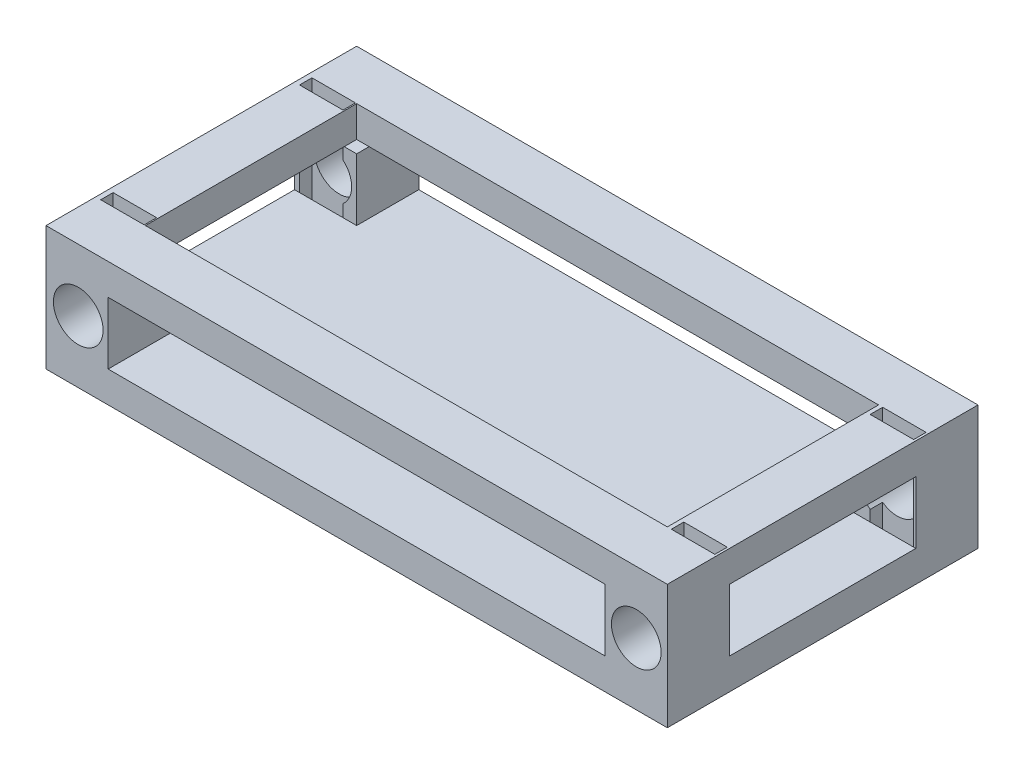
from build123d import *

# Parameters (mm, degrees)
SKETCH_1_W           = 10
SKETCH_1_H           = 10
EXTRUDE_2_DEPTH      = 10
EXTRUDE_2_2_DEPTH    = 10
EXTRUDE_2_3_DEPTH    = 10
EXTRUDE_2_4_DEPTH    = 10
SKETCH_2_W           = 100
SKETCH_2_H           = 50
EXTRUDE_3_DEPTH      = 5
SKETCH_4_W           = 100
SKETCH_4_H           = 5
EXTRUDE_4_DEPTH      = 50
SKETCH_7_R           = 4
CUT_EXTRUDE_7_DEPTH  = 100
SKETCH_8_W           = 84
SKETCH_8_H           = 34
CUT_EXTRUDE_9_DEPTH  = 5
CUT_EXTRUDE_12_REACH = 78.195
SKETCH_10_W          = 7
SKETCH_10_H          = 2
CUT_EXTRUDE_13_REACH = 78.195
SKETCH_12_W          = 7
SKETCH_12_H          = 2


with BuildPart() as part:
    # 草图1 → 凸台-拉伸2 (new body)
    with BuildSketch(Plane(origin=(0, 0, 0), x_dir=(1, 0, 0), z_dir=(0, 1, 0))):
        with Locations((-31.40167364, 31.889818689)):
            Rectangle(SKETCH_1_W, SKETCH_1_H)
    extrude(amount=EXTRUDE_2_DEPTH)



with BuildPart() as body_2:
    # 草图1 → Extrude 2 2 (new body)
    with BuildSketch(Plane(origin=(0, 0, 0), x_dir=(1, 0, 0), z_dir=(0, 1, 0))):
        with Locations((-31.40167364, -8.110181311)):
            Rectangle(SKETCH_1_W, SKETCH_1_H)
    extrude(amount=EXTRUDE_2_2_DEPTH)


with BuildPart() as body_3:
    # 草图1 → Extrude 2 3 (new body)
    with BuildSketch(Plane(origin=(0, 0, 0), x_dir=(1, 0, 0), z_dir=(0, 1, 0))):
        with Locations((58.59832636, 31.889818689)):
            Rectangle(SKETCH_1_W, SKETCH_1_H)
    extrude(amount=EXTRUDE_2_3_DEPTH)


with BuildPart() as body_4:
    # 草图1 → Extrude 2 4 (new body)
    with BuildSketch(Plane(origin=(0, 0, 0), x_dir=(1, 0, 0), z_dir=(0, 1, 0))):
        with Locations((58.59832636, -8.110181311)):
            Rectangle(SKETCH_1_W, SKETCH_1_H)
    extrude(amount=EXTRUDE_2_4_DEPTH)


with BuildPart() as part_1:
    add(part.part)

    add(body_2.part)  # 凸台-拉伸3 merges body 2

    add(body_3.part)  # 凸台-拉伸3 merges body 3

    add(body_4.part)  # 凸台-拉伸3 merges body 4
    # 草图2 → 凸台-拉伸3 (add)
    with BuildSketch(Plane(origin=(0, 0, 0), x_dir=(1, 0, 0), z_dir=(0, 1, 0))):
        with Locations((13.59832636, 11.889818689)):
            Rectangle(SKETCH_2_W, SKETCH_2_H)
    extrude(amount=-EXTRUDE_3_DEPTH)

    # 草图4 → 凸台-拉伸4 (add)
    with BuildSketch(Plane.XY.offset(13.110181311)):
        with Locations((13.59832636, 12.5)):
            Rectangle(SKETCH_4_W, SKETCH_4_H)
    extrude(amount=-EXTRUDE_4_DEPTH)

    # 草图7 → 切除-拉伸7 (cut)
    with BuildSketch(Plane.XY.offset(13.110181311)):
        with Locations((-31.20937541, 5)):
            Circle(SKETCH_7_R)
        with Locations((58.59832636, 5)):
            Circle(SKETCH_7_R)
    extrude(amount=-CUT_EXTRUDE_7_DEPTH, mode=Mode.SUBTRACT)

    # 草图8 → 切除-拉伸9 (cut)
    with BuildSketch(Plane(origin=(0, 15, 0), x_dir=(1, 0, 0), z_dir=(0, 1, 0))):
        with Locations((13.59832636, 11.889818689)):
            Rectangle(SKETCH_8_W, SKETCH_8_H)
    extrude(amount=-CUT_EXTRUDE_9_DEPTH, mode=Mode.SUBTRACT)

    # 草图10 → 切除-拉伸12 (cut, up to next)
    with BuildSketch(Plane(origin=(0, 15, 0), x_dir=(1, 0, 0), z_dir=(0, 1, 0)), mode=Mode.PRIVATE) as cut_extrude_12_sk1:
        with Locations((-32.098969847, 27.889818689)):
            Rectangle(SKETCH_10_W, SKETCH_10_H)
    cut_extrude_12_tool1 = extrude(cut_extrude_12_sk1.sketch, amount=-CUT_EXTRUDE_12_REACH, mode=Mode.PRIVATE) & part_1.part
    add(cut_extrude_12_tool1.solids().sort_by_distance((-32.09897, 15, -27.889819))[0], mode=Mode.SUBTRACT)

    # 草图12 → 切除-拉伸13 (cut, up to next)
    with BuildSketch(Plane(origin=(0, 15, 0), x_dir=(1, 0, 0), z_dir=(0, 1, 0)), mode=Mode.PRIVATE) as cut_extrude_13_sk1:
        with Locations((-32.098969847, -4.110181311)):
            Rectangle(SKETCH_12_W, SKETCH_12_H)
    cut_extrude_13_tool1 = extrude(cut_extrude_13_sk1.sketch, amount=-CUT_EXTRUDE_13_REACH, mode=Mode.PRIVATE) & part_1.part
    # 草图12 → 切除-拉伸13 (cut, up to next)
    with BuildSketch(Plane(origin=(0, 15, 0), x_dir=(1, 0, 0), z_dir=(0, 1, 0)), mode=Mode.PRIVATE) as cut_extrude_13_sk2:
        with Locations((59.745274347, 27.889818689)):
            Rectangle(SKETCH_12_W, SKETCH_12_H)
    cut_extrude_13_tool2 = extrude(cut_extrude_13_sk2.sketch, amount=-CUT_EXTRUDE_13_REACH, mode=Mode.PRIVATE) & part_1.part
    # 草图12 → 切除-拉伸13 (cut, up to next)
    with BuildSketch(Plane(origin=(0, 15, 0), x_dir=(1, 0, 0), z_dir=(0, 1, 0)), mode=Mode.PRIVATE) as cut_extrude_13_sk3:
        with Locations((59.745274347, -4.110181311)):
            Rectangle(SKETCH_12_W, SKETCH_12_H)
    cut_extrude_13_tool3 = extrude(cut_extrude_13_sk3.sketch, amount=-CUT_EXTRUDE_13_REACH, mode=Mode.PRIVATE) & part_1.part
    add(cut_extrude_13_tool1.solids().sort_by_distance((-32.09897, 15, 4.110181))[0], mode=Mode.SUBTRACT)
    add(cut_extrude_13_tool2.solids().sort_by_distance((59.745274, 15, -27.889819))[0], mode=Mode.SUBTRACT)
    add(cut_extrude_13_tool3.solids().sort_by_distance((59.745274, 15, 4.110181))[0], mode=Mode.SUBTRACT)


solid = part_1.part
